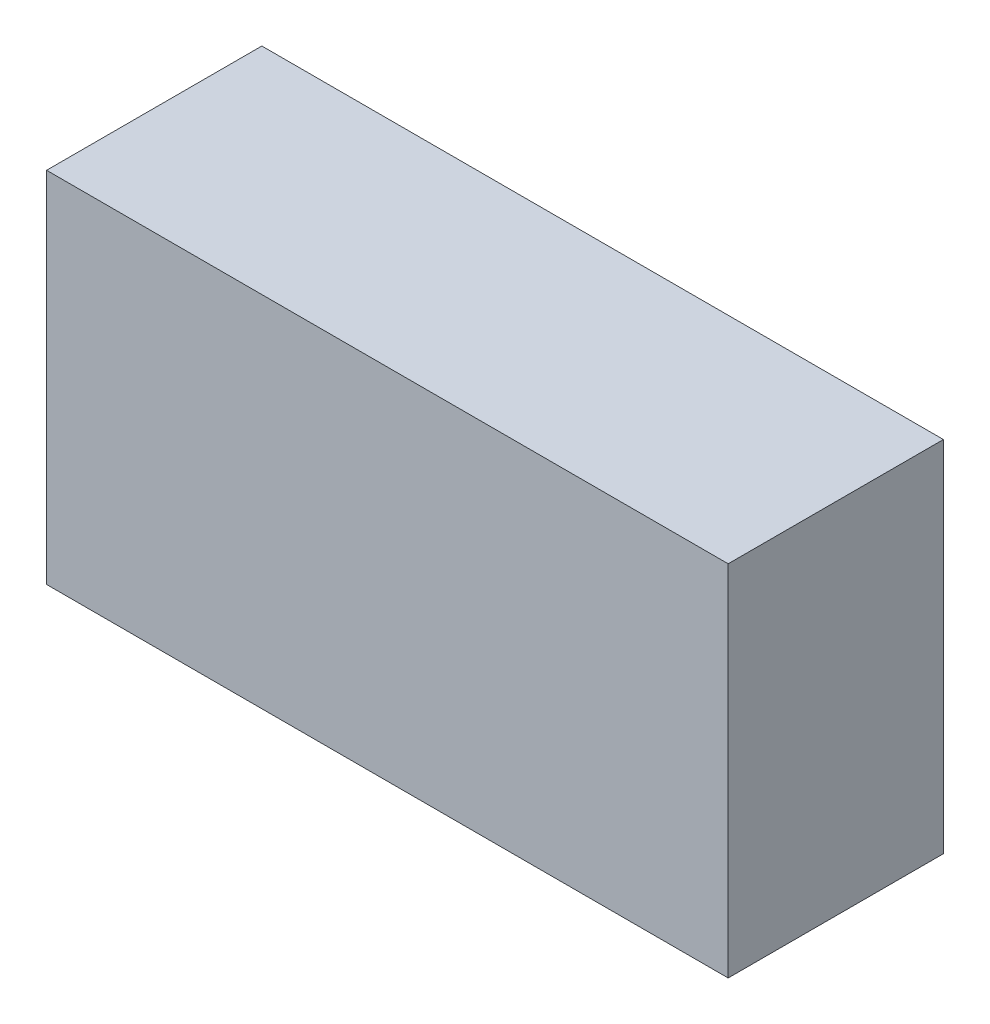
from build123d import *

# Parameters (mm, degrees)
SKETCH1_W           = 380
SKETCH1_H           = 120
BOSS_EXTRUDE1_DEPTH = 200


with BuildPart() as part:
    # Sketch1 → Boss-Extrude1 (new body)
    with BuildSketch(Plane(origin=(0, 0, 0), x_dir=(1, 0, 0), z_dir=(0, 1, 0))):
        Rectangle(SKETCH1_W, SKETCH1_H)
    extrude(amount=BOSS_EXTRUDE1_DEPTH)


solid = part.part
